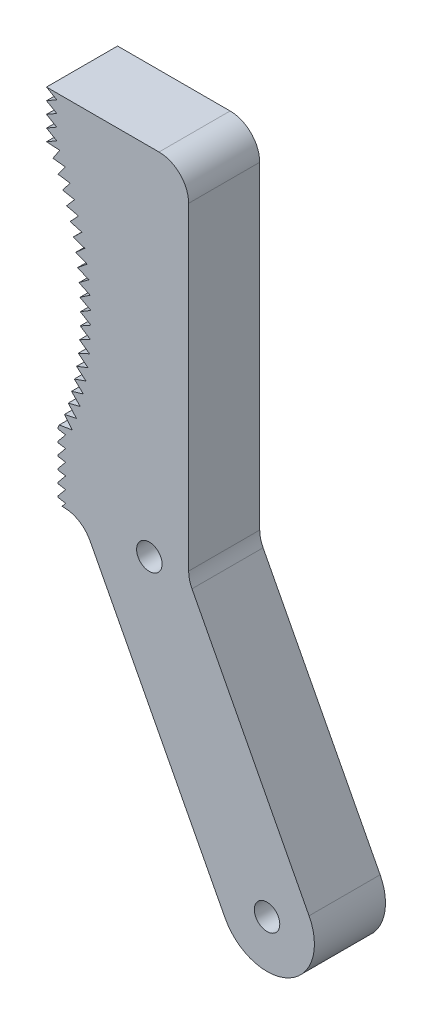
from build123d import *

# Parameters (mm, degrees)
SKETCH1_R           = 2.15
BOSS_EXTRUDE1_DEPTH = 12
CUT_EXTRUDE1_DEPTH  = 66.726706901
LPATTERN1_COUNT     = 4
LPATTERN1_PITCH     = 2
FILLET1_R           = 5
CUT_EXTRUDE2_DEPTH  = 66.726706901
CIRPATTERN1_COUNT   = 20
CIRPATTERN1_ANGLE   = 47
CUT_EXTRUDE3_DEPTH  = 66.726706901
LPATTERN2_COUNT     = 8
LPATTERN2_PITCH     = 2


with BuildPart() as part:
    # Sketch1 → Boss-Extrude1 (new body)
    with BuildSketch(Plane.XY):
        with BuildLine():
            Line((0, 60), (0, 0))
            Line((0, 0), (20.330487993, -39.021420502))
            ThreePointArc((20.330487993, -39.021420502), (16.932136627, -49.812676592), (6.140880537, -46.414325226))
            Line((6.140880537, -46.414325226), (-18.041372942, 0))
            Line((-18.041372942, 0), (-22.041372942, 0))
            Line((-22.041372942, 0), (-22.041372942, 11.19846791))
            ThreePointArc((-22.041372942, 11.19846791), (-18.473951147, 31.817494358), (-24, 52))
            Line((-24, 52), (-24, 60))
            Line((-24, 60), (0, 60))
        make_face()
        with Locations((-6.63687696, 0)):
            Circle(SKETCH1_R, mode=Mode.SUBTRACT)
        with Locations((13.235684265, -42.717872864)):
            Circle(SKETCH1_R, mode=Mode.SUBTRACT)
    extrude(amount=BOSS_EXTRUDE1_DEPTH)

    # Sketch2 → Cut-Extrude1 (cut, through all)
    with BuildSketch(Plane.XY.offset(12)):
        Polygon((-24, 60), (-22.267949192, 59), (-24, 58), align=None)
    cut_extrude1 = extrude(amount=-CUT_EXTRUDE1_DEPTH, mode=Mode.SUBTRACT)

    # LPattern1: Cut-Extrude1 ×4
    with Locations(*[(0, -i * LPATTERN1_PITCH, 0) for i in range(1, LPATTERN1_COUNT)]):
        add(cut_extrude1, mode=Mode.SUBTRACT)

    # Fillet1
    fillet1_edges = [part.edges().sort_by_distance(p)[0] for p in [
        (0, 60, 6),
        (0, 0, 6),
        (-18.041372942, 0, 6),
    ]]
    fillet(fillet1_edges, radius=FILLET1_R)

    # Sketch3 → Cut-Extrude2 (cut, through all)
    with BuildSketch(Plane.XY.offset(12)):
        Polygon((-24, 52), (-21.768387007, 51.865267087), (-23.000875629, 50), align=None)
    cut_extrude2 = extrude(amount=-CUT_EXTRUDE2_DEPTH, mode=Mode.SUBTRACT)

    # CirPattern1: Cut-Extrude2 ×20 about axis
    cirpattern1_axis = Axis((-66.515460733, 29.511321139, 0), (0, 0, -1))
    for i in range(1, CIRPATTERN1_COUNT):
        add(cut_extrude2.rotate(cirpattern1_axis, i * CIRPATTERN1_ANGLE / (CIRPATTERN1_COUNT - 1)), mode=Mode.SUBTRACT)

    # Sketch4 → Cut-Extrude3 (cut, through all)
    with BuildSketch(Plane.XY.offset(12)):
        Polygon((-22.740248565, 11.082790864), (-20.767949192, 10.751075349), (-22.041372942, 9.208871746), align=None)
    cut_extrude3 = extrude(amount=-CUT_EXTRUDE3_DEPTH, mode=Mode.SUBTRACT)

    # LPattern2: Cut-Extrude3 ×8
    with Locations(*[(0, -i * LPATTERN2_PITCH, 0) for i in range(1, LPATTERN2_COUNT)]):
        add(cut_extrude3, mode=Mode.SUBTRACT)


solid = part.part
